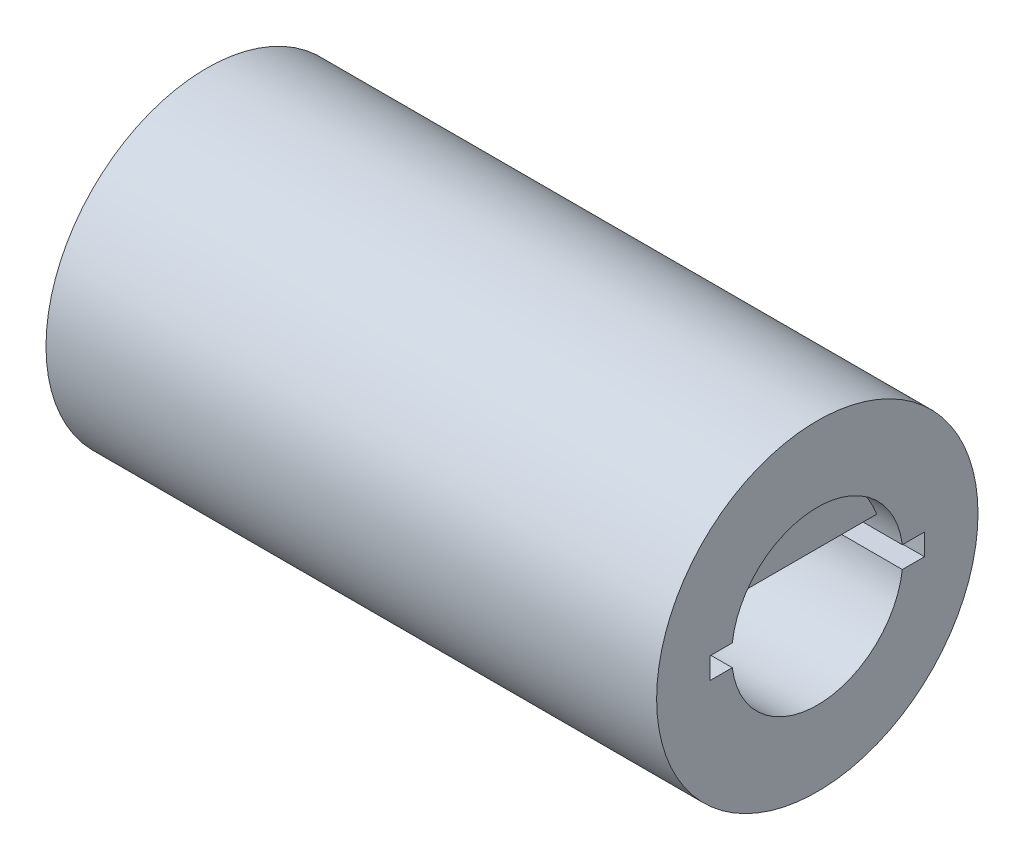
from build123d import *

# Parameters (mm, degrees)
SKETCH1_R           = 7.5
SKETCH1_R_2         = 4
BOSS_EXTRUDE1_DEPTH = 8
BOSS_EXTRUDE2_START = 1
SKETCH2_R           = 7.5
BOSS_EXTRUDE2_DEPTH = 1
BOSS_EXTRUDE3_DEPTH = 7
BOSS_EXTRUDE4_START = 17.5
SKETCH4_R           = 7.5
BOSS_EXTRUDE4_DEPTH = 17.5
BOSS_EXTRUDE5_START = 2
SKETCH5_R           = 7.5
SKETCH5_R_2         = 2.5
BOSS_EXTRUDE5_DEPTH = 2
SKETCH6_W           = 7
SKETCH6_H           = 1
CUT_EXTRUDE1_DEPTH  = 19.5
FILLET1_R           = 0.2
SKETCH7_W           = 10
SKETCH7_H           = 1
CUT_EXTRUDE2_DEPTH  = 8


with BuildPart() as part:
    # Sketch1 → Boss-Extrude1 (new body)
    with BuildSketch(Plane(origin=(0, 0, 0), x_dir=(0, 0, -1), z_dir=(1, 0, 0))):
        Circle(SKETCH1_R)
        Circle(SKETCH1_R_2, mode=Mode.SUBTRACT)
    extrude(amount=BOSS_EXTRUDE1_DEPTH)

    # Sketch2 → Boss-Extrude2 (add)
    with BuildSketch(Plane.ZY.offset(BOSS_EXTRUDE2_START)):
        Circle(SKETCH2_R)
    extrude(amount=-BOSS_EXTRUDE2_DEPTH)

    # Sketch3 → Boss-Extrude3 (add)
    with BuildSketch(Plane(origin=(0, 0, 0), x_dir=(0, 0, -1), z_dir=(1, 0, 0))):
        with BuildLine():
            Line((-3.771236166, 1.333333333), (3.771236166, 1.333333333))
            ThreePointArc((3.771236166, 1.333333333), (0, 4), (-3.771236166, 1.333333333))
        make_face()
    extrude(amount=BOSS_EXTRUDE3_DEPTH)

    # Sketch4 → Boss-Extrude4 (add)
    with BuildSketch(Plane.ZY.offset(1).offset(BOSS_EXTRUDE4_START)):
        Circle(SKETCH4_R)
        with BuildLine():
            ThreePointArc((1.5, -2), (0, 2.5), (-1.5, -2))
            Line((-1.5, -2), (1.5, -2))
        make_face(mode=Mode.SUBTRACT)
    extrude(amount=-BOSS_EXTRUDE4_DEPTH)

    # Sketch5 → Boss-Extrude5 (add)
    with BuildSketch(Plane.ZY.offset(18.5).offset(BOSS_EXTRUDE5_START)):
        Circle(SKETCH5_R)
        with Locations(Location((0, 0, 0), (0, 0, 233.130102354))):
            Circle(SKETCH5_R_2, mode=Mode.SUBTRACT)
    extrude(amount=-BOSS_EXTRUDE5_DEPTH)

    # Sketch6 → Cut-Extrude1 (cut)
    with BuildSketch(Plane.ZY.offset(20.5)):
        Rectangle(SKETCH6_W, SKETCH6_H)
    extrude(amount=-CUT_EXTRUDE1_DEPTH, mode=Mode.SUBTRACT)

    # Fillet1
    fillet1_edges = [part.edges().sort_by_distance(p)[0] for p in [
        (-9.75, 0.5, -2.449489743),
        (-9.75, 0.5, 2.449489743),
        (-9.75, -0.5, 2.449489743),
        (-9.75, -0.5, -2.449489743),
        (-10.75, 0.5, 3.5),
        (-10.75, -0.5, 3.5),
        (-10.75, -0.5, -3.5),
        (-10.75, 0.5, -3.5),
    ]]
    fillet(fillet1_edges, radius=FILLET1_R)

    # Sketch7 → Cut-Extrude2 (cut)
    with BuildSketch(Plane(origin=(8, 0, 0), x_dir=(0, 0, -1), z_dir=(1, 0, 0))):
        Rectangle(SKETCH7_W, SKETCH7_H)
    extrude(amount=-CUT_EXTRUDE2_DEPTH, mode=Mode.SUBTRACT)


solid = part.part
